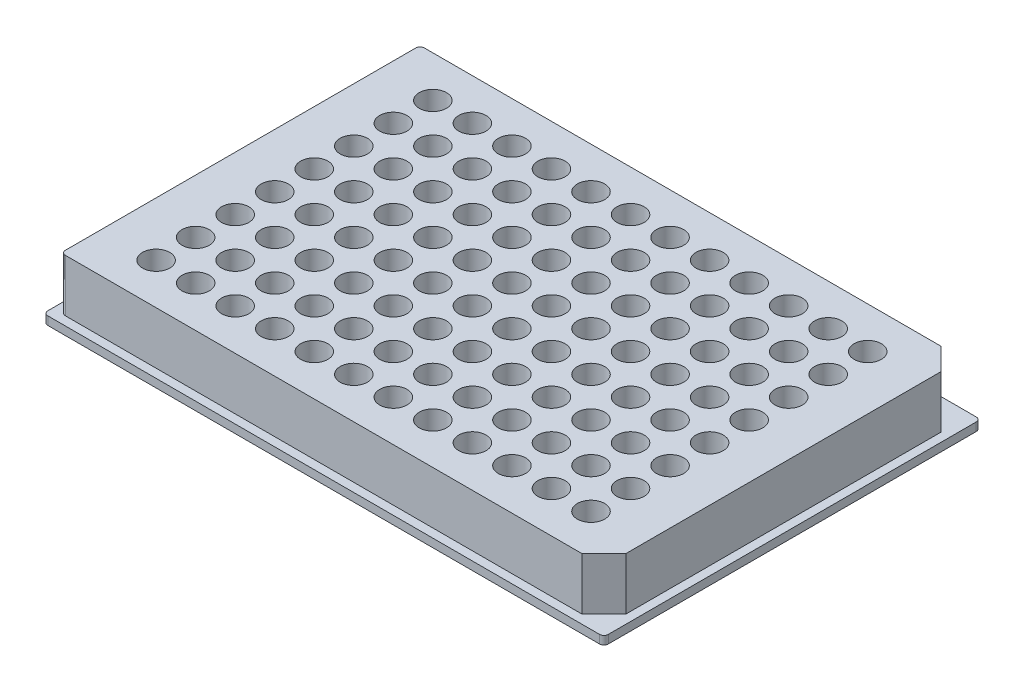
from build123d import *

# Parameters (mm, degrees)
SKETCH1_W            = 127.6
SKETCH1_H            = 85.75
BOSS_EXTRUDE1_DEPTH  = 1.9
SKETCH2_W            = 123.6
SKETCH2_H            = 81.75
BOSS_EXTRUDE2_DEPTH  = 11.93
CHAMFER1_SIZE        = 5
FILLET1_R            = 1
SKETCH3_R            = 3.105
CUT_EXTRUDE1_DEPTH   = 11.93
LPATTERN1_COUNT      = 12
LPATTERN1_PITCH      = 9
LPATTERN1_COUNT_DIR2 = 8
LPATTERN1_PITCH_DIR2 = 9
SKETCH4_W            = 125.6
SKETCH4_H            = 83.75
CUT_EXTRUDE2_DEPTH   = 1.7


with BuildPart() as part:
    # Sketch1 → Boss-Extrude1 (new body)
    with BuildSketch(Plane(origin=(0, 0, 0), x_dir=(1, 0, 0), z_dir=(0, 1, 0))):
        Rectangle(SKETCH1_W, SKETCH1_H)
    extrude(amount=BOSS_EXTRUDE1_DEPTH)

    # Sketch2 → Boss-Extrude2 (add)
    with BuildSketch(Plane(origin=(0, 1.9, 0), x_dir=(1, 0, 0), z_dir=(0, 1, 0))):
        Rectangle(SKETCH2_W, SKETCH2_H)
    extrude(amount=BOSS_EXTRUDE2_DEPTH)

    # Chamfer1
    chamfer1_edges = [part.edges().sort_by_distance(p)[0] for p in [
        (61.8, 7.865, 40.875),
        (61.8, 7.865, -40.875),
    ]]
    chamfer(chamfer1_edges, length=CHAMFER1_SIZE)

    # Fillet1
    fillet1_edges = [part.edges().sort_by_distance(p)[0] for p in [
        (-61.8, 7.865, -40.875),
        (-61.8, 7.865, 40.875),
        (63.8, 0.95, 42.875),
        (-63.8, 0.95, 42.875),
        (-63.8, 0.95, -42.875),
        (63.8, 0.95, -42.875),
    ]]
    fillet(fillet1_edges, radius=FILLET1_R)

    # Sketch3 → Cut-Extrude1 (cut)
    with BuildSketch(Plane(origin=(0, 13.83, 0), x_dir=(1, 0, 0), z_dir=(0, 1, 0))):
        with Locations(Location((-49.5, -31.515, 0), (0, 0, 270))):
            Circle(SKETCH3_R)
    cut_extrude1 = extrude(amount=-CUT_EXTRUDE1_DEPTH, mode=Mode.SUBTRACT)

    # LPattern1: Cut-Extrude1 12 × 8
    with Locations(*[(i * LPATTERN1_PITCH, 0, -j * LPATTERN1_PITCH_DIR2) for i in range(LPATTERN1_COUNT) for j in range(LPATTERN1_COUNT_DIR2) if (i, j) != (0, 0)]):
        add(cut_extrude1, mode=Mode.SUBTRACT)

    # Sketch4 → Cut-Extrude2 (cut)
    with BuildSketch(Plane.XZ):
        Rectangle(SKETCH4_W, SKETCH4_H)
    extrude(amount=-CUT_EXTRUDE2_DEPTH, mode=Mode.SUBTRACT)


solid = part.part
